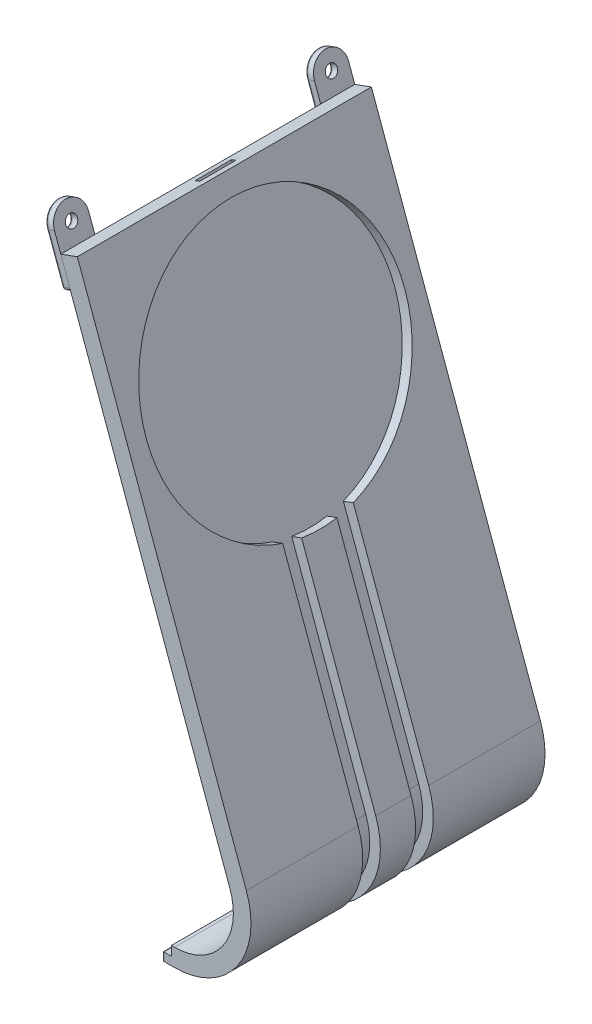
from build123d import *

# Parameters (mm, degrees)
EXTRUDE_1_DEPTH       = 25
SKETCH_4_R            = 22
CUT_EXTRUDE_1_DEPTH   = 1.8
CUT_EXTRUDE_START     = 6
CUT_EXTRUDE_1_2_DEPTH = 3
SKETCH_11_W           = 19
SKETCH_11_H           = 1.4
EXTRUDE_3_DEPTH       = 1.5
FILLET_1_R            = 0.25
SKETCH_15_R           = 1
EXTRUDE_1_2_DEPTH     = 1.5
EXTRUDE_1_2_2_DEPTH   = 1.5
SKETCH_14_W           = 0.8
SKETCH_14_H           = 6.2
CUT_EXTRUDE_2_DEPTH   = 1
FILLET_2_R            = 0.5
FILLET_3_R            = 0.5


with BuildPart() as part:
    # 草图2 → Extrude 1 (new, symmetric)
    with BuildSketch(Plane.XY):
        with BuildLine():
            Line((30.469246085, 6.049687275), (31.002548264, 6.049687275))
            ThreePointArc((31.002548264, 6.049687275), (39.194068707, 10.313922912), (40.399474472, 19.469888708))
            Line((40.399474472, 19.469888708), (11.65650271, 98.440554593))
            Line((11.65650271, 98.440554593), (14.475580572, 99.466615023))
            Line((14.475580572, 99.466615023), (43.218552334, 20.495949138))
            ThreePointArc((43.218552334, 20.495949138), (41.65152484, 8.593193603), (31.002548264, 3.049687275))
            Line((31.002548264, 3.049687275), (30.469246085, 3.049687275))
            Line((30.469246085, 3.049687275), (30.469246085, 6.049687275))
        make_face()
    extrude(amount=EXTRUDE_1_DEPTH, both=True)

    # 草图4 → Cut-Extrude 1 (cut)
    with BuildSketch(Plane(origin=(44.750213172, 16.287745572, 0), x_dir=(0, 0, -1), z_dir=(0.9396926207859071, 0.3420201433256726, 0))):
        with Locations(Location((0, 63.117104009, 0), (0, 0, 90))):
            Circle(SKETCH_4_R)
    extrude(amount=-CUT_EXTRUDE_1_DEPTH, mode=Mode.SUBTRACT)

    # 草图3 → Cut-Extrude 1 2 (cut)
    with BuildSketch(Plane.XY.offset(CUT_EXTRUDE_START)):
        with BuildLine():
            ThreePointArc((30.469246085, 4.86239141), (40.021460965, 9.408963392), (41.527105617, 19.88031288))
            Line((41.527105617, 19.88031288), (28.995888649, 54.30954854))
            Line((28.995888649, 54.30954854), (27.969828219, 57.128626402))
            Line((27.969828219, 57.128626402), (29.661274936, 57.74426266))
            Line((29.661274936, 57.74426266), (30.687335366, 54.925184798))
            Line((30.687335366, 54.925184798), (43.218552334, 20.495949138))
            ThreePointArc((43.218552334, 20.495949138), (41.470929078, 8.341704197), (30.383536806, 3.064433145))
            Line((30.383536806, 3.064433145), (30.469246085, 4.86239141))
        make_face()
    cut_extrude_1_2 = extrude(amount=-CUT_EXTRUDE_1_2_DEPTH, mode=Mode.SUBTRACT)

    # 镜向1: Cut-Extrude 1 2 across plane
    add(cut_extrude_1_2.mirror(Plane.XY), mode=Mode.SUBTRACT)

    # 草图11 → 底部卡扣凸台-拉伸3 (add)
    with BuildSketch(Plane.ZY.offset(-30.469246085)):
        with Locations((-15.5, 3.749687275)):
            Rectangle(SKETCH_11_W, SKETCH_11_H)
        with Locations((15.5, 3.749687275)):
            Rectangle(SKETCH_11_W, SKETCH_11_H)
    extrude(amount=EXTRUDE_3_DEPTH)

    # 底部卡扣圆角1
    fillet_1_edges = [part.edges().sort_by_distance(p)[0] for p in [
        (28.969246085, 3.749687275, 6),
        (28.969246085, 3.049687275, 15.5),
        (28.969246085, 3.749687275, 25),
        (28.969246085, 4.449687275, 15.5),
        (28.969246085, 3.749687275, -25),
        (28.969246085, 3.049687275, -15.5),
        (28.969246085, 3.749687275, -6),
        (28.969246085, 4.449687275, -15.5),
    ]]
    fillet(fillet_1_edges, radius=FILLET_1_R)

    # 草图14 → 扣部切除-拉伸2 (cut)
    with BuildSketch(Plane(origin=(-30.2746326, 83.178869451, 0), x_dir=(0.9396926207859067, 0.3420201433256736, 0), z_dir=(-0.3420201433256736, 0.9396926207859068, 0))):
        with Locations((46.022182172, 0)):
            Rectangle(SKETCH_14_W, SKETCH_14_H)
    extrude(amount=-CUT_EXTRUDE_2_DEPTH, mode=Mode.SUBTRACT)


with BuildPart() as body_2:
    # 草图15 → Extrude 1 2 (new body)
    with BuildSketch(Plane(origin=(41.93113531, 15.261685142, 0), x_dir=(0, 0, 1), z_dir=(-0.9396926207859068, -0.34202014332567304, 0))):
        with BuildLine():
            Line((-25, 91.617104009), (-25, 83.517104009))
            Line((-25, 83.517104009), (-19.2, 83.517104009))
            Line((-19.2, 83.517104009), (-19.2, 91.617104009))
            ThreePointArc((-19.2, 91.617104009), (-22.1, 94.517104009), (-25, 91.617104009))
        make_face()
        with Locations(Location((-22.1, 91.617104009, 0), (0, 0, 90))):
            Circle(SKETCH_15_R, mode=Mode.SUBTRACT)
    extrude(amount=EXTRUDE_1_2_DEPTH)

    # 螺丝圆角2
    fillet_2_edges = [body_2.edges().sort_by_distance(p)[0] for p in [
        (9.528721478, 99.900878881, -22.1),
        (11.957064495, 93.229061274, -22.1),
        (10.571882915, 97.034816388, -19.2),
        (8.194842919, 103.565680103, -22.1),
        (12.661833961, 93.485576381, -19.2),
        (12.661833961, 93.485576381, -25),
        (10.571882915, 97.034816388, -25),
    ]]
    fillet(fillet_2_edges, radius=FILLET_2_R)


with BuildPart() as body_3:
    # 草图15 → Extrude 1 2 2 (new body)
    with BuildSketch(Plane(origin=(41.93113531, 15.261685142, 0), x_dir=(0, 0, 1), z_dir=(-0.9396926207859068, -0.34202014332567304, 0))):
        with BuildLine():
            Line((19.2, 91.617104009), (19.2, 83.517104009))
            Line((19.2, 83.517104009), (25, 83.517104009))
            Line((25, 83.517104009), (25, 91.617104009))
            ThreePointArc((25, 91.617104009), (22.1, 94.517104009), (19.2, 91.617104009))
        make_face()
        with Locations(Location((22.1, 91.617104009, 0), (0, 0, 90))):
            Circle(SKETCH_15_R, mode=Mode.SUBTRACT)
    extrude(amount=EXTRUDE_1_2_2_DEPTH)

    # 螺丝圆角3
    fillet_3_edges = [body_3.edges().sort_by_distance(p)[0] for p in [
        (9.528721478, 99.900878881, 22.1),
        (11.957064495, 93.229061274, 22.1),
        (10.571882915, 97.034816388, 25),
        (8.194842919, 103.565680103, 22.1),
        (12.661833961, 93.485576381, 25),
        (12.661833961, 93.485576381, 19.2),
        (10.571882915, 97.034816388, 19.2),
    ]]
    fillet(fillet_3_edges, radius=FILLET_3_R)


solid = Compound([part.part, body_2.part, body_3.part])
